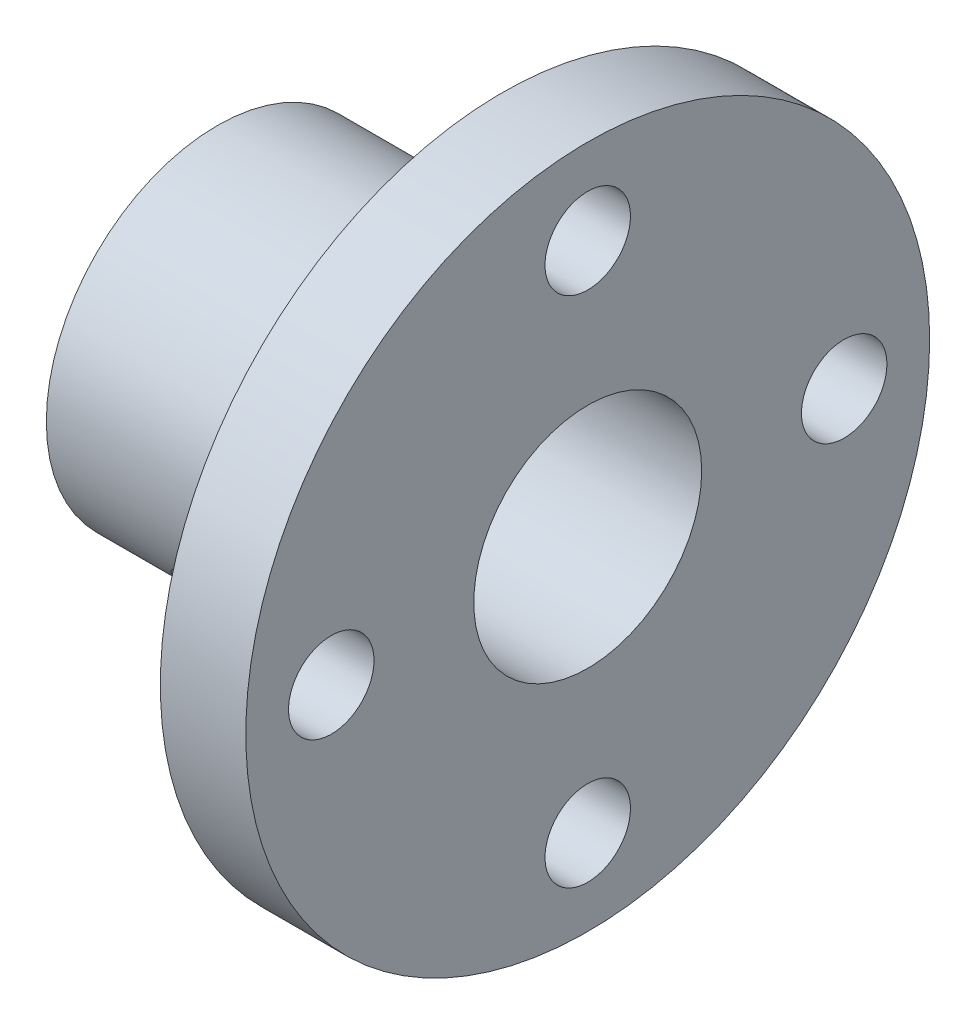
from build123d import *

# Parameters (mm, degrees)
SKETCH1_R           = 6
SKETCH1_R_2         = 4
BOSS_EXTRUDE1_DEPTH = 10
SKETCH2_R           = 12
SKETCH2_R_2         = 1.5
SKETCH2_R_3         = 4
BOSS_EXTRUDE3_DEPTH = 3
SKETCH3_R           = 2
CUT_EXTRUDE1_DEPTH  = 3


with BuildPart() as part:
    # Sketch1 → Boss-Extrude1 (new body)
    with BuildSketch(Plane(origin=(0, 0, 0), x_dir=(0, 0, -1), z_dir=(1, 0, 0))):
        Circle(SKETCH1_R)
        Circle(SKETCH1_R_2, mode=Mode.SUBTRACT)
    extrude(amount=BOSS_EXTRUDE1_DEPTH)

    # Sketch2 → Boss-Extrude3 (add)
    with BuildSketch(Plane(origin=(10, 0, 0), x_dir=(0, 0, -1), z_dir=(1, 0, 0))):
        Circle(SKETCH2_R)
        with Locations((0, 9)):
            Circle(SKETCH2_R_2, mode=Mode.SUBTRACT)
        with Locations((-9, 0)):
            Circle(SKETCH2_R_2, mode=Mode.SUBTRACT)
        with Locations((0, -9)):
            Circle(SKETCH2_R_2, mode=Mode.SUBTRACT)
        with Locations((9, 0)):
            Circle(SKETCH2_R_2, mode=Mode.SUBTRACT)
        Circle(SKETCH2_R_3, mode=Mode.SUBTRACT)
    extrude(amount=BOSS_EXTRUDE3_DEPTH)

    # Sketch3 → Cut-Extrude1 (cut)
    with BuildSketch(Plane(origin=(0, -4.242640687, 4.242640687), x_dir=(-1, 0, 0), z_dir=(0, -0.7071067811865488, 0.7071067811865464))):
        with Locations(Location((-5, 0, 0), (0, 0, 90))):
            Circle(SKETCH3_R)
    extrude(amount=-CUT_EXTRUDE1_DEPTH, mode=Mode.SUBTRACT)


solid = part.part
